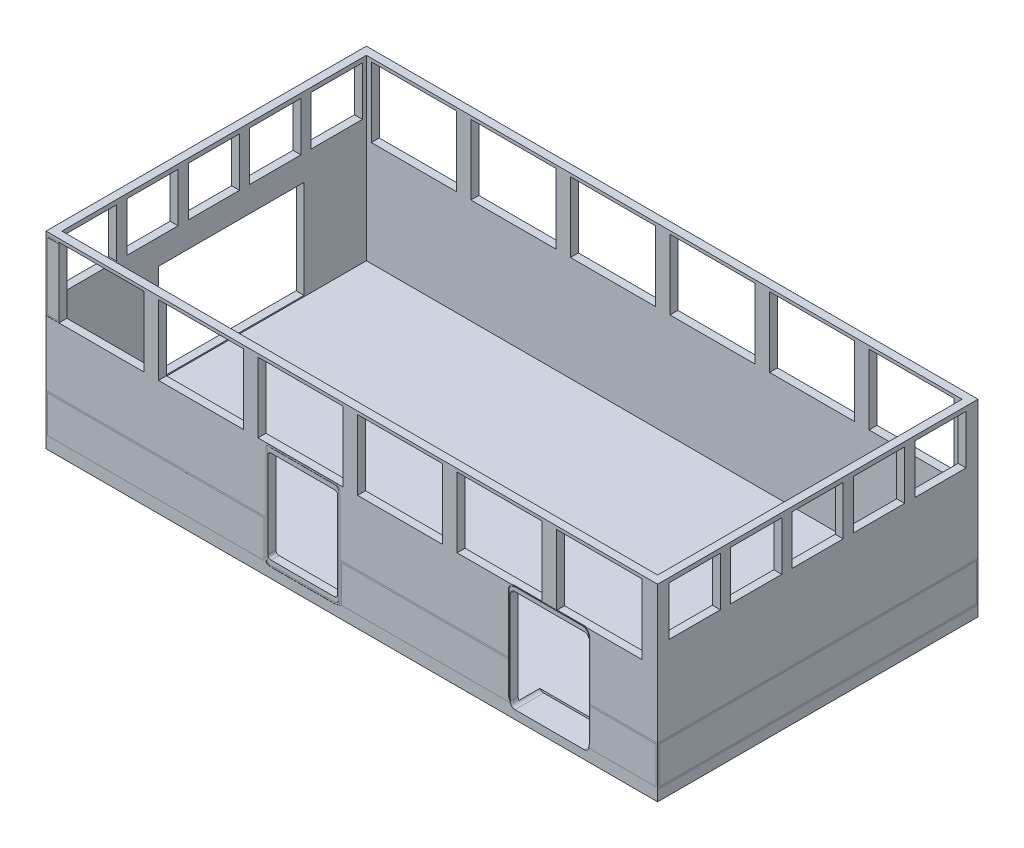
from build123d import *

# Parameters (mm, degrees)
CROQUIS1_W              = 11550
CROQUIS1_H              = 6050
CROQUIS1_W_2            = 11250
CROQUIS1_H_2            = 5750
SALIENTE_EXTRUIR1_DEPTH = 3360
CROQUIS2_W              = 11550
CROQUIS2_H              = 6050
SALIENTE_EXTRUIR2_DEPTH = 200
CROQUIS3_W              = 1421.245135369
CROQUIS3_H              = 1320.863661001
CROQUIS3_W_2            = 1361.245135369
CROQUIS3_H_2            = 1260.863661001
CORTAR_EXTRUIR1_DEPTH   = 3
CROQUIS5_W              = 967.506215509
CROQUIS5_H              = 925.440727879
CORTAR_EXTRUIR3_DEPTH   = 12126
MATRIZL3_COUNT          = 5
MATRIZL3_PITCH          = 1160
CORTAR_EXTRUIR4_DEPTH   = 3
CROQUIS7_W              = 11550
CROQUIS7_H              = 200
CORTAR_EXTRUIR5_DEPTH   = 0.011
CORTAR_EXTRUIR6_DEPTH   = 0.011
CROQUIS9_W              = 11549.989
CROQUIS9_H              = 200
CORTAR_EXTRUIR7_DEPTH   = 0.011
CORTAR_EXTRUIR8_DEPTH   = 0.011
CROQUIS11_W             = 1607.207689623
CROQUIS11_H             = 1320.863661001
CORTAR_EXTRUIR9_DEPTH   = 6503.011
MATRIZL4_COUNT          = 6
MATRIZL4_PITCH          = 1880
CORTAR_EXTRUIR10_DEPTH  = 0.011
CROQUIS13_W             = 4150
CROQUIS13_H             = 758.52635577
CROQUIS13_W_2           = 4090
CROQUIS13_H_2           = 698.52635577
CROQUIS13_W_3           = 6000
CROQUIS13_W_4           = 5940
CORTAR_EXTRUIR13_DEPTH  = 0.011
CORTAR_EXTRUIR14_DEPTH  = 0.0011
SALIENTE_EXTRUIR3_DEPTH = 0.0011
CORTAR_EXTRUIR15_DEPTH  = 10
CORTAR_EXTRUIR16_DEPTH  = 10
CORTAR_EXTRUIR17_DEPTH  = 625
CORTAR_EXTRUIR18_DEPTH  = 543
CROQUIS23_W             = 2762.039538742
CROQUIS23_H             = 1868.483182202
CORTAR_EXTRUIR19_DEPTH  = 10
CROQUIS25_W             = 2750.657036516
CROQUIS25_H             = 1848.593075284
CORTAR_EXTRUIR20_DEPTH  = 679


with BuildPart() as part:
    # Croquis1 → Saliente-Extruir1 (new body)
    with BuildSketch(Plane(origin=(0, 0, 0), x_dir=(1, 0, 0), z_dir=(0, 1, 0))):
        Rectangle(CROQUIS1_W, CROQUIS1_H)
        Rectangle(CROQUIS1_W_2, CROQUIS1_H_2, mode=Mode.SUBTRACT)
    extrude(amount=SALIENTE_EXTRUIR1_DEPTH)

    # Croquis2 → Saliente-Extruir2 (add)
    with BuildSketch(Plane.XZ):
        Rectangle(CROQUIS2_W, CROQUIS2_H)
    extrude(amount=SALIENTE_EXTRUIR2_DEPTH)

    # Croquis3 → Cortar-Extruir1 (cut)
    with BuildSketch(Plane.XY.offset(3025)):
        with Locations((-5064.377432316, 2640.431830501)):
            Rectangle(CROQUIS3_W, CROQUIS3_H)
        with Locations((-5064.377432316, 2640.431830501)):
            Rectangle(CROQUIS3_W_2, CROQUIS3_H_2, mode=Mode.SUBTRACT)
    extrude(amount=-CORTAR_EXTRUIR1_DEPTH, mode=Mode.SUBTRACT)

    # Croquis5 → Cortar-Extruir3 (cut)
    with BuildSketch(Plane.ZY.offset(5775)):
        with Locations((2323.859616869, 2811.999763921)):
            Rectangle(CROQUIS5_W, CROQUIS5_H)
    cortar_extruir3 = extrude(amount=-CORTAR_EXTRUIR3_DEPTH, mode=Mode.SUBTRACT)

    # MatrizL3: Cortar-Extruir3 ×5
    with Locations(*[(0, 0, -i * MATRIZL3_PITCH) for i in range(1, MATRIZL3_COUNT)]):
        add(cortar_extruir3, mode=Mode.SUBTRACT)

    # Croquis6 → Cortar-Extruir4 (cut)
    with BuildSketch(Plane.XY.offset(3025)):
        with BuildLine():
            Line((-1535, 1969.318267569), (-315, 1969.318267569))
            ThreePointArc((-315, 1969.318267569), (-251.360389693, 1942.957877875), (-225, 1879.318267569))
            Line((-225, 1879.318267569), (-225, 79.318267569))
            ThreePointArc((-225, 79.318267569), (-251.360389693, 15.678657262), (-315, -10.681732431))
            Line((-315, -10.681732431), (-1535, -10.681732431))
            ThreePointArc((-1535, -10.681732431), (-1598.639610307, 15.678657262), (-1625, 79.318267569))
            Line((-1625, 79.318267569), (-1625, 1879.318267569))
            ThreePointArc((-1625, 1879.318267569), (-1598.639610307, 1942.957877875), (-1535, 1969.318267569))
        make_face()
        with BuildLine():
            ThreePointArc((-1535, 1939.318267569), (-1577.426406871, 1921.74467444), (-1595, 1879.318267569))
            Line((-1595, 1879.318267569), (-1595, 79.318267569))
            ThreePointArc((-1595, 79.318267569), (-1577.426406871, 36.891860698), (-1535, 19.318267569))
            Line((-1535, 19.318267569), (-315, 19.318267569))
            ThreePointArc((-315, 19.318267569), (-272.573593129, 36.891860698), (-255, 79.318267569))
            Line((-255, 79.318267569), (-255, 1879.318267569))
            ThreePointArc((-255, 1879.318267569), (-272.573593129, 1921.74467444), (-315, 1939.318267569))
            Line((-315, 1939.318267569), (-1535, 1939.318267569))
        make_face(mode=Mode.SUBTRACT)
    extrude(amount=-CORTAR_EXTRUIR4_DEPTH, mode=Mode.SUBTRACT)

    # Croquis7 → Cortar-Extruir5 (cut)
    with BuildSketch(Plane.XY.offset(3025)):
        with Locations((0, -100)):
            Rectangle(CROQUIS7_W, CROQUIS7_H)
    extrude(amount=-CORTAR_EXTRUIR5_DEPTH, mode=Mode.SUBTRACT)

    # Croquis8 → Cortar-Extruir6 (cut)
    with BuildSketch(Plane(origin=(5775, 0, 0), x_dir=(0, 0, -1), z_dir=(1, 0, 0))):
        Polygon((-3024.989, -200), (-3025, 0), (3025, 0), (3025, -200), align=None)
    extrude(amount=-CORTAR_EXTRUIR6_DEPTH, mode=Mode.SUBTRACT)

    # Croquis9 → Cortar-Extruir7 (cut)
    with BuildSketch(Plane(origin=(0, 0, -3025), x_dir=(-1, 0, 0), z_dir=(0, 0, -1))):
        with Locations((0.0055, -100)):
            Rectangle(CROQUIS9_W, CROQUIS9_H)
    extrude(amount=-CORTAR_EXTRUIR7_DEPTH, mode=Mode.SUBTRACT)

    # Croquis10 → Cortar-Extruir8 (cut)
    with BuildSketch(Plane.ZY.offset(5775)):
        Polygon((-3024.989, -200), (-3024.989, 0), (3024.989, -10.681732431), (3024.989, -200), align=None)
    extrude(amount=-CORTAR_EXTRUIR8_DEPTH, mode=Mode.SUBTRACT)

    # Croquis11 → Cortar-Extruir9 (cut)
    with BuildSketch(Plane(origin=(0, 0, -3025), x_dir=(-1, 0, 0), z_dir=(0, 0, -1))):
        with Locations((4727.737848639, 2640.431830501)):
            Rectangle(CROQUIS11_W, CROQUIS11_H)
    cortar_extruir9 = extrude(amount=-CORTAR_EXTRUIR9_DEPTH, mode=Mode.SUBTRACT)

    # MatrizL4: Cortar-Extruir9 ×6
    with Locations(*[(i * MATRIZL4_PITCH, 0, 0) for i in range(1, MATRIZL4_COUNT)]):
        add(cortar_extruir9, mode=Mode.SUBTRACT)

    # Croquis12 → Cortar-Extruir10 (cut)
    with BuildSketch(Plane.ZY.offset(5775)):
        Polygon((-1775, -2.206958115), (-1775, 1954.119709372), (1125, 1954.119709372), (1125, -7.327145998), align=None)
        Polygon((-1745, 27.740121184), (-1745, 1924.119709372), (1095, 1924.119709372), (1095, 22.725868222), align=None, mode=Mode.SUBTRACT)
    extrude(amount=-CORTAR_EXTRUIR10_DEPTH, mode=Mode.SUBTRACT)

    # Croquis13 → Cortar-Extruir13 (cut)
    # profile 1 of 2: a face of its own
    with BuildSketch(Plane.XY.offset(3025)):
        with Locations((-3700, 379.263177885)):
            Rectangle(CROQUIS13_W, CROQUIS13_H)
        with Locations((-3700, 379.263177885)):
            Rectangle(CROQUIS13_W_2, CROQUIS13_H_2, mode=Mode.SUBTRACT)
    # profile 2 of 2: a face of its own
    with BuildSketch(Plane.XY.offset(3025)):
        with Locations((2775, 379.263177885)):
            Rectangle(CROQUIS13_W_3, CROQUIS13_H)
        with Locations((2775, 379.263177885)):
            Rectangle(CROQUIS13_W_4, CROQUIS13_H_2, mode=Mode.SUBTRACT)
    extrude(amount=-CORTAR_EXTRUIR13_DEPTH, mode=Mode.SUBTRACT)

    # Croquis14 → Cortar-Extruir14 (cut)
    with BuildSketch(Plane(origin=(5775, 0, 0), x_dir=(0, 0, -1), z_dir=(1, 0, 0))):
        Polygon((-3024.989, 758.52635577), (3025, 758.52635577), (3024.989, 0), (-3024.989, 0), align=None)
        Polygon((-2994.989, 30), (-2994.989, 728.52635577), (2994.999564943, 728.52635577), (2994.989435051, 30), align=None, mode=Mode.SUBTRACT)
    extrude(amount=-CORTAR_EXTRUIR14_DEPTH, mode=Mode.SUBTRACT)

    # Croquis16 → Saliente-Extruir3 (add)
    with BuildSketch(Plane(origin=(0, 0, -3025), x_dir=(-1, 0, 0), z_dir=(0, 0, -1))):
        Polygon((-5775, 0), (5774.989, 0), (5775, 758.52635577), (-5774.99945, 758.52635577), align=None)
    extrude(amount=SALIENTE_EXTRUIR3_DEPTH)

    # Croquis17 → Cortar-Extruir15 (cut)
    with BuildSketch(Plane.ZY.offset(5775)):
        Polygon((-1745, 1924.119709372), (-1745, 27.740121184), (1095, 22.725868222), (1095, 1924.119709372), align=None)
    extrude(amount=-CORTAR_EXTRUIR15_DEPTH, mode=Mode.SUBTRACT)

    # Croquis18 → Cortar-Extruir16 (cut)
    with BuildSketch(Plane.XY.offset(3025)):
        with BuildLine():
            Line((2955, 1849.318267569), (2955, 150))
            ThreePointArc((2955, 150), (2996.005050634, 51.005050634), (3095, 10))
            Line((3095, 10), (4355, 10))
            ThreePointArc((4355, 10), (4453.994949366, 51.005050634), (4495, 150))
            Line((4495, 150), (4495, 1849.318267569))
            ThreePointArc((4495, 1849.318267569), (4453.994949366, 1948.313216935), (4355, 1989.318267569))
            Line((4355, 1989.318267569), (3095, 1989.318267569))
            ThreePointArc((3095, 1989.318267569), (2996.005050634, 1948.313216935), (2955, 1849.318267569))
        make_face()
        with BuildLine():
            Line((2975, 1849.318267569), (2975, 150))
            ThreePointArc((2975, 150), (3010.147186258, 65.147186258), (3095, 30))
            Line((3095, 30), (4355, 30))
            ThreePointArc((4355, 30), (4439.852813742, 65.147186258), (4475, 150))
            Line((4475, 150), (4475, 1849.318267569))
            ThreePointArc((4475, 1849.318267569), (4439.852813742, 1934.171081311), (4355, 1969.318267569))
            Line((4355, 1969.318267569), (3095, 1969.318267569))
            ThreePointArc((3095, 1969.318267569), (3010.147186258, 1934.171081311), (2975, 1849.318267569))
        make_face(mode=Mode.SUBTRACT)
    extrude(amount=-CORTAR_EXTRUIR16_DEPTH, mode=Mode.SUBTRACT)

    # Croquis19 → Cortar-Extruir17 (cut)
    with BuildSketch(Plane.XY.offset(3025)):
        with BuildLine():
            Line((-325.958364973, 104.318267569), (-1524.041635027, 104.318267569))
            ThreePointArc((-1524.041635027, 104.318267569), (-1566.468041898, 121.891860698), (-1584.041635027, 164.318267569))
            Line((-1584.041635027, 164.318267569), (-1584.041635027, 1794.318267569))
            ThreePointArc((-1584.041635027, 1794.318267569), (-1566.468041898, 1836.74467444), (-1524.041635027, 1854.318267569))
            Line((-1524.041635027, 1854.318267569), (-325.958364973, 1854.318267569))
            ThreePointArc((-325.958364973, 1854.318267569), (-283.531958102, 1836.74467444), (-265.958364973, 1794.318267569))
            Line((-265.958364973, 1794.318267569), (-265.958364973, 164.318267569))
            ThreePointArc((-265.958364973, 164.318267569), (-283.531958102, 121.891860698), (-325.958364973, 104.318267569))
        make_face()
    extrude(amount=-CORTAR_EXTRUIR17_DEPTH, mode=Mode.SUBTRACT)

    # Croquis22 → Cortar-Extruir18 (cut)
    with BuildSketch(Plane.XY.offset(3025)):
        with BuildLine():
            Line((3080.336392686, 1891.432008981), (4388.809361072, 1891.432008981))
            ThreePointArc((4388.809361072, 1891.432008981), (4452.448971379, 1865.071619288), (4478.809361072, 1801.432008981))
            Line((4478.809361072, 1801.432008981), (4478.809361072, 51.432008981))
            ThreePointArc((4478.809361072, 51.432008981), (4452.448971379, -12.207601326), (4388.809361072, -38.567991019))
            Line((4388.809361072, -38.567991019), (3080.336392686, -38.567991019))
            ThreePointArc((3080.336392686, -38.567991019), (3016.696782379, -12.207601326), (2990.336392686, 51.432008981))
            Line((2990.336392686, 51.432008981), (2990.336392686, 1801.432008981))
            ThreePointArc((2990.336392686, 1801.432008981), (3016.696782379, 1865.071619288), (3080.336392686, 1891.432008981))
        make_face()
    extrude(amount=-CORTAR_EXTRUIR18_DEPTH, mode=Mode.SUBTRACT)

    # Croquis23 → Cortar-Extruir19 (cut)
    with BuildSketch(Plane.ZY.offset(5775)):
        with Locations((-327.356690612, 957.040443048)):
            Rectangle(CROQUIS23_W, CROQUIS23_H)
    extrude(amount=-CORTAR_EXTRUIR19_DEPTH, mode=Mode.SUBTRACT)

    # Croquis25 → Cortar-Extruir20 (cut)
    with BuildSketch(Plane.ZY.offset(5765)):
        with Locations((-321.665439499, 947.095389589)):
            Rectangle(CROQUIS25_W, CROQUIS25_H)
    extrude(amount=-CORTAR_EXTRUIR20_DEPTH, mode=Mode.SUBTRACT)


solid = part.part
